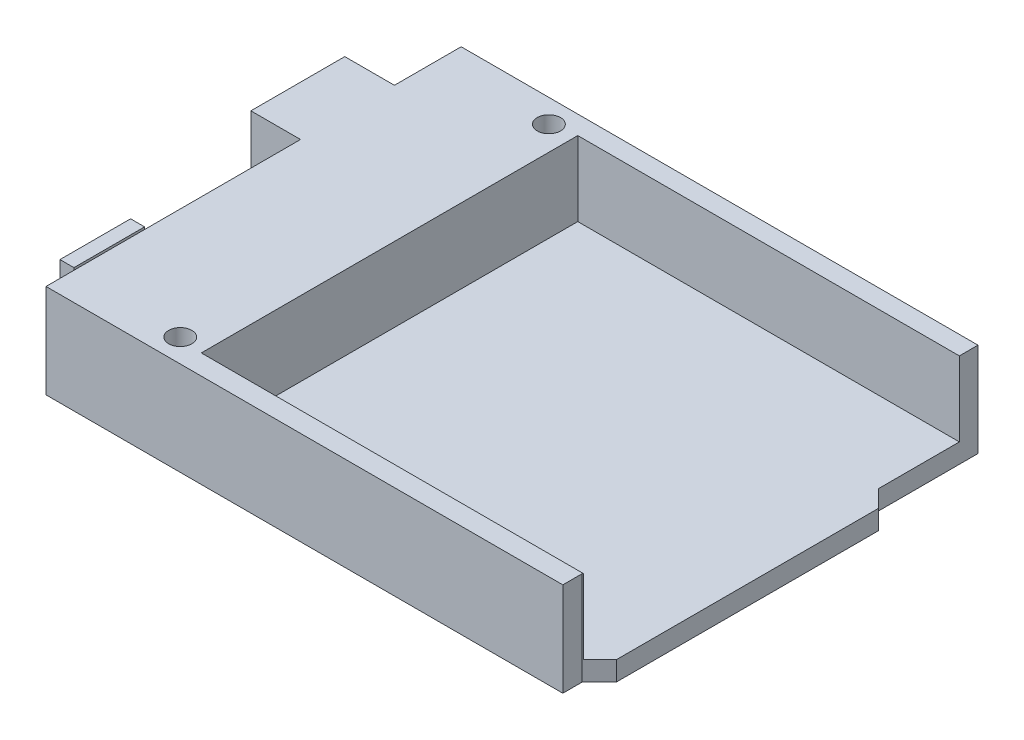
from build123d import *

# Parameters (mm, degrees)
SKETCH2_W           = 68.8
SKETCH2_H           = 53.5
BOSS_EXTRUDE1_DEPTH = 12.1
CUT_EXTRUDE1_DEPTH  = 12.1
SKETCH4_W           = 12.1
SKETCH4_H           = 10.6
BOSS_EXTRUDE2_DEPTH = 6.4
SKETCH5_W           = 9.1
SKETCH5_H           = 10.9
BOSS_EXTRUDE3_DEPTH = 1.8
SKETCH7_R           = 1.5
CUT_EXTRUDE2_DEPTH  = 12.1
SKETCH8_W           = 66.515944673
SKETCH8_H           = 48.513400954
CUT_EXTRUDE3_DEPTH  = 9.6


with BuildPart() as part:
    # Sketch2 → Boss-Extrude1 (new body)
    with BuildSketch(Plane(origin=(0, 0, 0), x_dir=(1, 0, 0), z_dir=(0, 1, 0))):
        with Locations((34.4, 26.75)):
            Rectangle(SKETCH2_W, SKETCH2_H)
    extrude(amount=BOSS_EXTRUDE1_DEPTH)

    # Sketch3 → Cut-Extrude1 (cut)
    with BuildSketch(Plane(origin=(0, 12.1, 0), x_dir=(1, 0, 0), z_dir=(0, 1, 0))):
        Polygon((68.8, 0), (68.8, 4.7), (66.6, 2.5), (66.6, 0), align=None)
        Polygon((68.8, 53.5), (66.6, 53.5), (66.6, 40.7), (68.8, 38.5), align=None)
    extrude(amount=-CUT_EXTRUDE1_DEPTH, mode=Mode.SUBTRACT)

    # Sketch4 → Boss-Extrude2 (add)
    with BuildSketch(Plane.ZY):
        with Locations((-38.85, 6.8)):
            Rectangle(SKETCH4_W, SKETCH4_H)
    extrude(amount=BOSS_EXTRUDE2_DEPTH)

    # Sketch5 → Boss-Extrude3 (add)
    with BuildSketch(Plane.ZY):
        with Locations((-8.15, 6.95)):
            Rectangle(SKETCH5_W, SKETCH5_H)
    extrude(amount=BOSS_EXTRUDE3_DEPTH)

    # Sketch7 → Cut-Extrude2 (cut)
    with BuildSketch(Plane(origin=(0, 12.1, 0), x_dir=(1, 0, 0), z_dir=(0, 1, 0))):
        with Locations(Location((14.3, 50.5, 0), (0, 0, 270))):
            Circle(SKETCH7_R)
        with Locations(Location((14.3, 3, 0), (0, 0, 270))):
            Circle(SKETCH7_R)
    extrude(amount=-CUT_EXTRUDE2_DEPTH, mode=Mode.SUBTRACT)

    # Sketch8 → Cut-Extrude3 (cut)
    with BuildSketch(Plane(origin=(0, 12.1, 0), x_dir=(1, 0, 0), z_dir=(0, 1, 0))):
        with Locations((50.682931162, 26.843299523)):
            Rectangle(SKETCH8_W, SKETCH8_H)
    extrude(amount=-CUT_EXTRUDE3_DEPTH, mode=Mode.SUBTRACT)


solid = part.part
